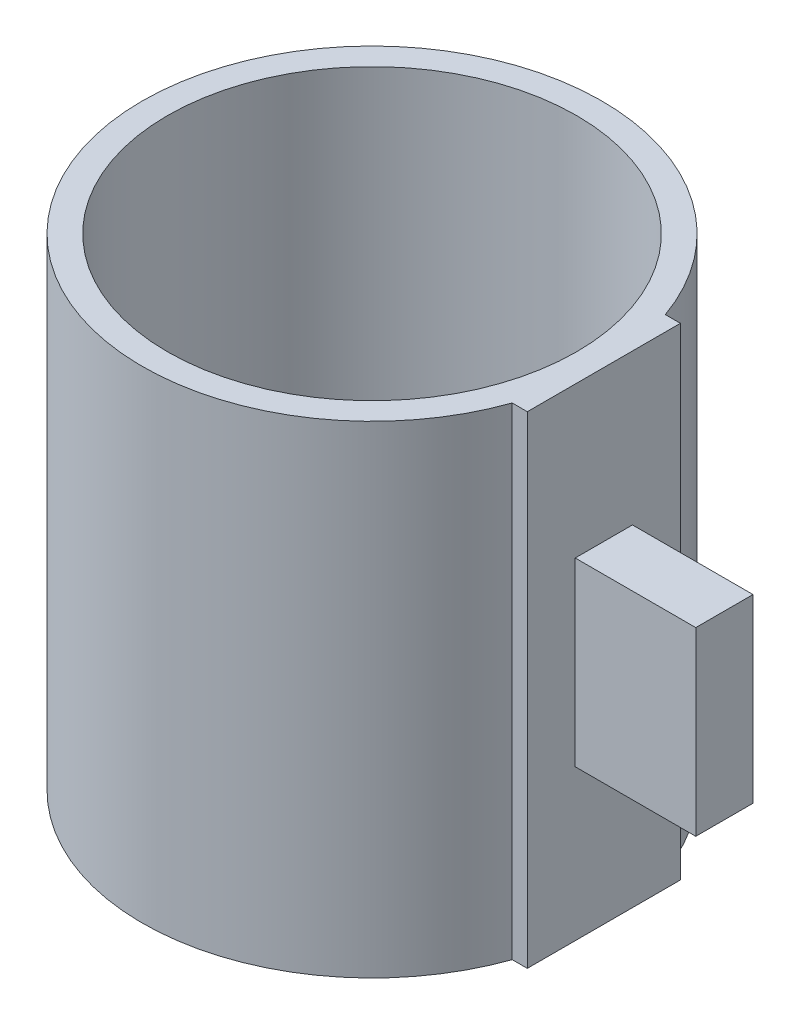
from build123d import *

# Parameters (mm, degrees)
SKETCH1_R           = 33.95
BOSS_EXTRUDE1_DEPTH = 80
SKETCH2_W           = 9.5
SKETCH2_H           = 30
BOSS_EXTRUDE2_DEPTH = 20


with BuildPart() as part:
    # Sketch1 → Boss-Extrude1 (new body)
    with BuildSketch(Plane(origin=(0, 0, 0), x_dir=(1, 0, 0), z_dir=(0, 1, 0))):
        with BuildLine():
            Line((35.963448111, -12.7), (38.463448111, -12.7))
            Line((38.463448111, -12.7), (38.463448111, 12.7))
            Line((38.463448111, 12.7), (35.963448111, 12.7))
            ThreePointArc((35.963448111, 12.7), (-38.14, 0), (35.963448111, -12.7))
        make_face()
        with Locations(Location((0, 0, 0), (0, 0, 270))):
            Circle(SKETCH1_R, mode=Mode.SUBTRACT)
    extrude(amount=BOSS_EXTRUDE1_DEPTH)

    # Sketch2 → Boss-Extrude2 (add)
    with BuildSketch(Plane(origin=(38.463448111, 0, 0), x_dir=(0, 0, -1), z_dir=(1, 0, 0))):
        with Locations((0, 40)):
            Rectangle(SKETCH2_W, SKETCH2_H)
    extrude(amount=BOSS_EXTRUDE2_DEPTH)


solid = part.part
